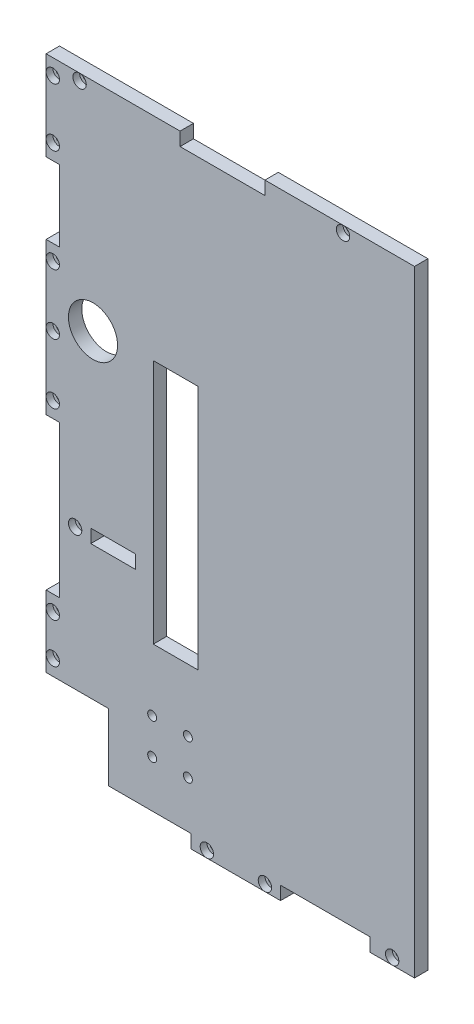
from build123d import *

# Parameters (mm, degrees)
ESQUISSE1_W             = 165
ESQUISSE1_H             = 276
BOSS_EXTRU_1_DEPTH      = 6
ESQUISSE2_W             = 38
ESQUISSE2_H             = 6
ESQUISSE2_W_2           = 6
ESQUISSE2_H_2           = 32
ESQUISSE2_H_3           = 68
ESQUISSE2_W_3           = 40
EXTERIEUR_DEPTH         = 10
ESQUISSE3_R             = 11
ESQUISSE3_W             = 20
ESQUISSE3_H             = 6
ENL_V_MAT_EXTRU_2_DEPTH = 322.616230934
ESQUISSE4_R             = 1.5
ESQUISSE4_R_2           = 1.005
ENL_V_MAT_EXTRU_3_DEPTH = 322.616230934
ESQUISSE5_R             = 2.995
ESQUISSE5_R_2           = 3
ESQUISSE5_R_3           = 2
ENL_V_MAT_EXTRU_4_DEPTH = 3
ESQUISSE6_W             = 20
ESQUISSE6_H             = 110
ENL_V_MAT_EXTRU_5_DEPTH = 322.616230934


with BuildPart() as part:
    # Esquisse1 → Boss.-Extru.1 (new body)
    with BuildSketch(Plane.XY):
        with Locations((-82.5, 138)):
            Rectangle(ESQUISSE1_W, ESQUISSE1_H)
    extrude(amount=BOSS_EXTRU_1_DEPTH)

    # Esquisse2 → exterieur (cut)
    with BuildSketch(Plane.XY.offset(6)):
        with Locations((-86, 273)):
            Rectangle(ESQUISSE2_W, ESQUISSE2_H)
        with Locations((-162, 220)):
            Rectangle(ESQUISSE2_W_2, ESQUISSE2_H_2)
        with Locations((-162, 102)):
            Rectangle(ESQUISSE2_W_2, ESQUISSE2_H_3)
        Polygon((-137, 36), (-137, 6), (-100, 6), (-100, 0), (-165, 0), (-165, 36), align=None)
        with Locations((-40, 3)):
            Rectangle(ESQUISSE2_W_3, ESQUISSE2_H)
    extrude(amount=-EXTERIEUR_DEPTH, mode=Mode.SUBTRACT)

    # Esquisse3 → Enlèv. mat.-Extru.2 (cut, through all)
    with BuildSketch(Plane.XY.offset(6)):
        with Locations((-144, 178.92)):
            Circle(ESQUISSE3_R)
        with Locations((-135, 99)):
            Rectangle(ESQUISSE3_W, ESQUISSE3_H)
    extrude(amount=-ENL_V_MAT_EXTRU_2_DEPTH, mode=Mode.SUBTRACT)

    # Esquisse4 → Enlèv. mat.-Extru.3 (cut, through all)
    with BuildSketch(Plane.XY.offset(6)):
        with Locations((-32, 273)):
            Circle(ESQUISSE4_R)
        with Locations((-150, 273)):
            Circle(ESQUISSE4_R)
        with Locations((-162, 197)):
            Circle(ESQUISSE4_R)
        with Locations((-162, 170)):
            Circle(ESQUISSE4_R)
        with Locations((-162, 143)):
            Circle(ESQUISSE4_R)
        with Locations((-162, 61)):
            Circle(ESQUISSE4_R)
        with Locations((-162, 43)):
            Circle(ESQUISSE4_R)
        with Locations((-93, 3)):
            Circle(ESQUISSE4_R)
        with Locations((-67, 3)):
            Circle(ESQUISSE4_R)
        with Locations((-10, 3)):
            Circle(ESQUISSE4_R)
        with Locations((-152, 99)):
            Circle(ESQUISSE4_R)
        with Locations((-162, 243)):
            Circle(ESQUISSE4_R)
        with Locations((-101.5, 43)):
            Circle(ESQUISSE4_R_2)
        with Locations((-117.5, 43)):
            Circle(ESQUISSE4_R_2)
        with Locations((-101.5, 27)):
            Circle(ESQUISSE4_R_2)
        with Locations((-117.5, 27)):
            Circle(ESQUISSE4_R_2)
        with Locations((-162, 269)):
            Circle(ESQUISSE4_R)
    extrude(amount=-ENL_V_MAT_EXTRU_3_DEPTH, mode=Mode.SUBTRACT)

    # Esquisse5 → Enlèv. mat.-Extru.4 (cut)
    with BuildSketch(Plane.XY.offset(6)):
        with Locations((-150, 273)):
            Circle(ESQUISSE5_R)
        with Locations((-32, 273)):
            Circle(ESQUISSE5_R)
        with Locations((-162, 197)):
            Circle(ESQUISSE5_R)
        with Locations((-162, 170)):
            Circle(ESQUISSE5_R)
        with Locations((-162, 143)):
            Circle(ESQUISSE5_R)
        with Locations((-162, 61)):
            Circle(ESQUISSE5_R)
        with Locations((-162, 43)):
            Circle(ESQUISSE5_R)
        with Locations((-93, 3)):
            Circle(ESQUISSE5_R)
        with Locations((-67, 3)):
            Circle(ESQUISSE5_R)
        with Locations((-10, 3)):
            Circle(ESQUISSE5_R)
        with Locations((-152, 99)):
            Circle(ESQUISSE5_R_2)
        with Locations((-117.5, 43)):
            Circle(ESQUISSE5_R_3)
        with Locations((-101.5, 43)):
            Circle(ESQUISSE5_R_3)
        with Locations((-117.5, 27)):
            Circle(ESQUISSE5_R_3)
        with Locations((-101.5, 27)):
            Circle(ESQUISSE5_R_3)
        with Locations((-162, 269)):
            Circle(ESQUISSE5_R)
        with Locations((-162, 243)):
            Circle(ESQUISSE5_R)
    extrude(amount=-ENL_V_MAT_EXTRU_4_DEPTH, mode=Mode.SUBTRACT)

    # Esquisse6 → Enlèv. mat.-Extru.5 (cut, through all)
    with BuildSketch(Plane.XY.offset(6)):
        with Locations((-107, 126)):
            Rectangle(ESQUISSE6_W, ESQUISSE6_H)
    extrude(amount=-ENL_V_MAT_EXTRU_5_DEPTH, mode=Mode.SUBTRACT)


solid = part.part
